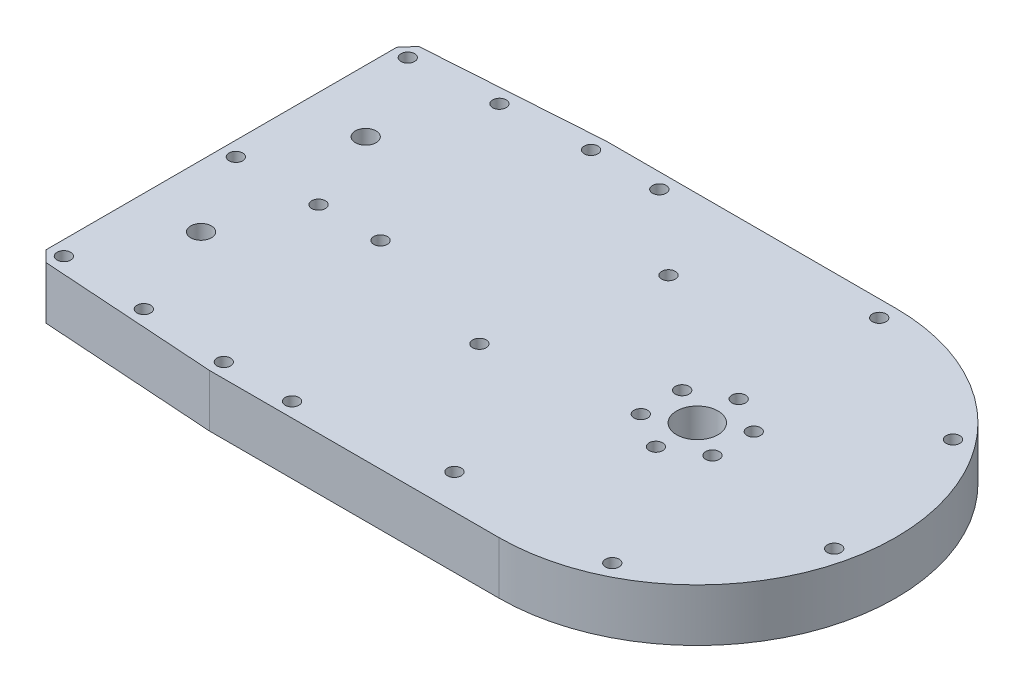
from build123d import *
from OCP.BRepFilletAPI import BRepFilletAPI_MakeChamfer

# Parameters (mm, degrees)
SKETCH1_R                 = 5
SKETCH1_R_2               = 1
BOSS_EXTRUDE1_DEPTH       = 12.7
SKETCH3_R                 = 1
CUT_EXTRUDE1_DEPTH        = 6.35
M4X0_7_TAPPED_HOLE1_D     = 3.3
CHAMFER1_SIZE             = 1
M4X0_7_TAPPED_HOLE2_D     = 3.3
M4X0_7_TAPPED_HOLE2_DEPTH = 10.1
M4X0_7_TAPPED_HOLE2_TIP   = 0.991420021
CHAMFER2_SIZE             = 2.5
CHAMFER2_SIZE2            = 2.68451721
SKETCH7_R                 = 0.25
SKETCH7_R_2               = 1
CUT_EXTRUDE2_DEPTH        = 126.26088775
M4X0_7_TAPPED_HOLE3_D     = 3.3
M4X0_7_TAPPED_HOLE3_DEPTH = 15.5
M4X0_7_TAPPED_HOLE3_TIP   = 0.991420021
M6X1_0_TAPPED_HOLE1_D     = 5
M6X1_0_TAPPED_HOLE1_DEPTH = 17
M6X1_0_TAPPED_HOLE1_TIP   = 1.502151548


with BuildPart() as part:
    # Sketch1 → Boss-Extrude1 (new body)
    with BuildSketch(Plane(origin=(0, 0, 0), x_dir=(1, 0, 0), z_dir=(0, 1, 0))):
        with BuildLine():
            Line((-115, 45), (-115, -45))
            Line((-115, -45), (-70, -48))
            Line((-70, -48), (0, -48))
            ThreePointArc((0, -48), (48, 0), (0, 48))
            Line((0, 48), (-70, 48))
            Line((-70, 48), (-115, 45))
        make_face()
        with Locations(Location((0, 0, 0), (0, 0, 270))):
            Circle(SKETCH1_R, mode=Mode.SUBTRACT)
        with Locations(Location((0, 10, 0), (0, 0, 270))):
            Circle(SKETCH1_R_2, mode=Mode.SUBTRACT)
        with Locations(Location((8.660254038, 5, 0), (0, 0, 270))):
            Circle(SKETCH1_R_2, mode=Mode.SUBTRACT)
        with Locations(Location((8.660254038, -5, 0), (0, 0, 270))):
            Circle(SKETCH1_R_2, mode=Mode.SUBTRACT)
        with Locations(Location((0, -10, 0), (0, 0, 270))):
            Circle(SKETCH1_R_2, mode=Mode.SUBTRACT)
        with Locations(Location((-8.660254038, -5, 0), (0, 0, 270))):
            Circle(SKETCH1_R_2, mode=Mode.SUBTRACT)
        with Locations(Location((-8.660254038, 5, 0), (0, 0, 270))):
            Circle(SKETCH1_R_2, mode=Mode.SUBTRACT)
    extrude(amount=BOSS_EXTRUDE1_DEPTH)

    # Sketch3 → Cut-Extrude1 (cut)
    with BuildSketch(Plane(origin=(0, 12.7, 0), x_dir=(1, 0, 0), z_dir=(0, 1, 0))):
        with Locations(Location((0, 44, 0), (0, 0, 270))):
            Circle(SKETCH3_R)
        with Locations(Location((34.400585229, 27.433551282, 0), (0, 0, 270))):
            Circle(SKETCH3_R)
        with Locations(Location((42.896828136, -9.790921094, 0), (0, 0, 270))):
            Circle(SKETCH3_R)
        with Locations(Location((19.090884521, -39.642630188, 0), (0, 0, 270))):
            Circle(SKETCH3_R)
        with Locations(Location((-19.090884521, -39.642630188, 0), (0, 0, 270))):
            Circle(SKETCH3_R)
        with Locations(Location((-42.896828136, -9.790921094, 0), (0, 0, 270))):
            Circle(SKETCH3_R)
        with Locations(Location((-34.400585229, 27.433551282, 0), (0, 0, 270))):
            Circle(SKETCH3_R)
    extrude(amount=-CUT_EXTRUDE1_DEPTH, mode=Mode.SUBTRACT)

    # M4x0.7 Tapped Hole1 (through all)
    with Locations(Plane(origin=(-19.090884521, 12.7, 39.642630188), x_dir=(0, 0, 1), z_dir=(0, 1, 0))):
        with Locations((0, 0), (-29.851709094, -23.805943615), (-83.642630188, 19.090884521), (-67.07618147, 53.49146975), (-29.851709094, 61.987712657), (0, 38.181769042), (-67.07618147, -15.309700708)):
            Hole(M4X0_7_TAPPED_HOLE1_D / 2)

    # Chamfer1
    chamfer1_edges = [part.edges().sort_by_distance(p)[0] for p in [
        (34.400585229, 0, -25.783551282),
        (0, 0, -42.35),
        (-42.896828136, 0, 11.440921094),
        (-19.090884521, 0, 41.292630188),
        (-34.400585229, 0, -25.783551282),
        (19.090884521, 0, 41.292630188),
        (42.896828136, 0, 11.440921094),
    ]]
    chamfer(chamfer1_edges, length=CHAMFER1_SIZE)

    # M4x0.7 Tapped Hole2
    with Locations(Plane(origin=(0, 12.7, -10), x_dir=(0, 0, 1), z_dir=(0, 1, 0))):
        with Locations((0, 0), (5, -8.660254038), (15, -8.660254038), (20, 0), (15, 8.660254038), (5, 8.660254038)):
            Hole(M4X0_7_TAPPED_HOLE2_D / 2, depth=M4X0_7_TAPPED_HOLE2_DEPTH)
            with Locations((0, 0, -(M4X0_7_TAPPED_HOLE2_DEPTH + M4X0_7_TAPPED_HOLE2_TIP / 2))):  # 118° drill point
                Cone(0, M4X0_7_TAPPED_HOLE2_D / 2, M4X0_7_TAPPED_HOLE2_TIP, mode=Mode.SUBTRACT)

    # Chamfer2: one chamfer whose edges measure the first distance from different faces: ONE call of the kernel's chamfer builder (chamfer() names one face for all edges)
    chamfer2_edges_1 = [part.edges().sort_by_distance(p)[0] for p in [
        (-115, 6.35, 45),
    ]]
    chamfer2_side_1 = [part.faces().sort_by_distance(p)[0] for p in [
        (-115, 6.35, 0),
    ]]
    chamfer2_edges_2 = [part.edges().sort_by_distance(p)[0] for p in [
        (-115, 6.35, -45),
    ]]
    chamfer2_side_2 = [part.faces().sort_by_distance(p)[0] for p in [
        (-92.5, 6.35, -46.5),
    ]]
    chamfer2 = BRepFilletAPI_MakeChamfer(part.part.solid().wrapped)
    for e in chamfer2_edges_1:
        chamfer2.Add(CHAMFER2_SIZE, CHAMFER2_SIZE2, e.wrapped, chamfer2_side_1[0].wrapped)  # the first distance lies on this face
    for e in chamfer2_edges_2:
        chamfer2.Add(CHAMFER2_SIZE, CHAMFER2_SIZE2, e.wrapped, chamfer2_side_2[0].wrapped)  # the first distance lies on this face
    add(Compound.cast(chamfer2.Shape()), mode=Mode.REPLACE)

    # Sketch7 → Cut-Extrude2 (cut, through all)
    with BuildSketch(Plane.XZ):
        with Locations(Location((-111.5, 41.678571429, 0), (0, 0, 270))):
            Circle(SKETCH7_R)
        with Locations(Location((-70, 44.5, 0), (0, 0, 270))):
            Circle(SKETCH7_R)
        with Locations(Location((-53.5, 44.5, 0), (0, 0, 270))):
            Circle(SKETCH7_R)
        with Locations(Location((-90.75, 43.089285714, 0), (0, 0, 270))):
            Circle(SKETCH7_R)
        with Locations(Location((-90.75, -42.904768504, 0), (0, 0, 90))):
            Circle(SKETCH7_R)
        with Locations(Location((-53.5, -44.31548279, 0), (0, 0, 90))):
            Circle(SKETCH7_R)
        with Locations(Location((-70, -44.31548279, 0), (0, 0, 90))):
            Circle(SKETCH7_R)
        with Locations(Location((-111.5, -41.494054218, 0), (0, 0, 90))):
            Circle(SKETCH7_R)
        with Locations(Location((-111.5, 0.092258605, 0), (0, 0, 270))):
            Circle(SKETCH7_R)
        with Locations(Location((-91.5, 0.092258605, 0), (0, 0, 270))):
            Circle(SKETCH7_R)
        with Locations(Location((-76.5, 0.092258605, 0), (0, 0, 270))):
            Circle(SKETCH7_R)
        with Locations(Location((-100, -19.81548279, 0), (0, 0, 270))):
            Circle(SKETCH7_R_2)
        with Locations(Location((-100, 20, 0), (0, 0, 270))):
            Circle(SKETCH7_R_2)
    extrude(amount=-CUT_EXTRUDE2_DEPTH, mode=Mode.SUBTRACT)

    # M4x0.7 Tapped Hole3
    with Locations(Plane(origin=(-90.75, 0, 43.089285714), x_dir=(0, 0, -1), z_dir=(0, -1, 0))):
        with Locations((0, 0), (1.410714285, -20.75), (-1.410714286, 20.75), (-1.410714286, 37.25), (42.997027109, -20.75), (42.997027109, -0.75), (42.997027109, 14.25), (84.583339932, -20.75), (85.994054218, 0), (87.404768504, 20.75), (87.404768504, 37.25)):
            Hole(M4X0_7_TAPPED_HOLE3_D / 2, depth=M4X0_7_TAPPED_HOLE3_DEPTH)
            with Locations((0, 0, -(M4X0_7_TAPPED_HOLE3_DEPTH + M4X0_7_TAPPED_HOLE3_TIP / 2))):  # 118° drill point
                Cone(0, M4X0_7_TAPPED_HOLE3_D / 2, M4X0_7_TAPPED_HOLE3_TIP, mode=Mode.SUBTRACT)

    # M6x1.0 Tapped Hole1
    with Locations(Plane(origin=(-100, 0, 20), x_dir=(0, 0, -1), z_dir=(0, -1, 0))):
        with Locations((0, 0), (39.81548279, 0)):
            Hole(M6X1_0_TAPPED_HOLE1_D / 2, depth=M6X1_0_TAPPED_HOLE1_DEPTH)
            with Locations((0, 0, -(M6X1_0_TAPPED_HOLE1_DEPTH + M6X1_0_TAPPED_HOLE1_TIP / 2))):  # 118° drill point
                Cone(0, M6X1_0_TAPPED_HOLE1_D / 2, M6X1_0_TAPPED_HOLE1_TIP, mode=Mode.SUBTRACT)


solid = part.part
